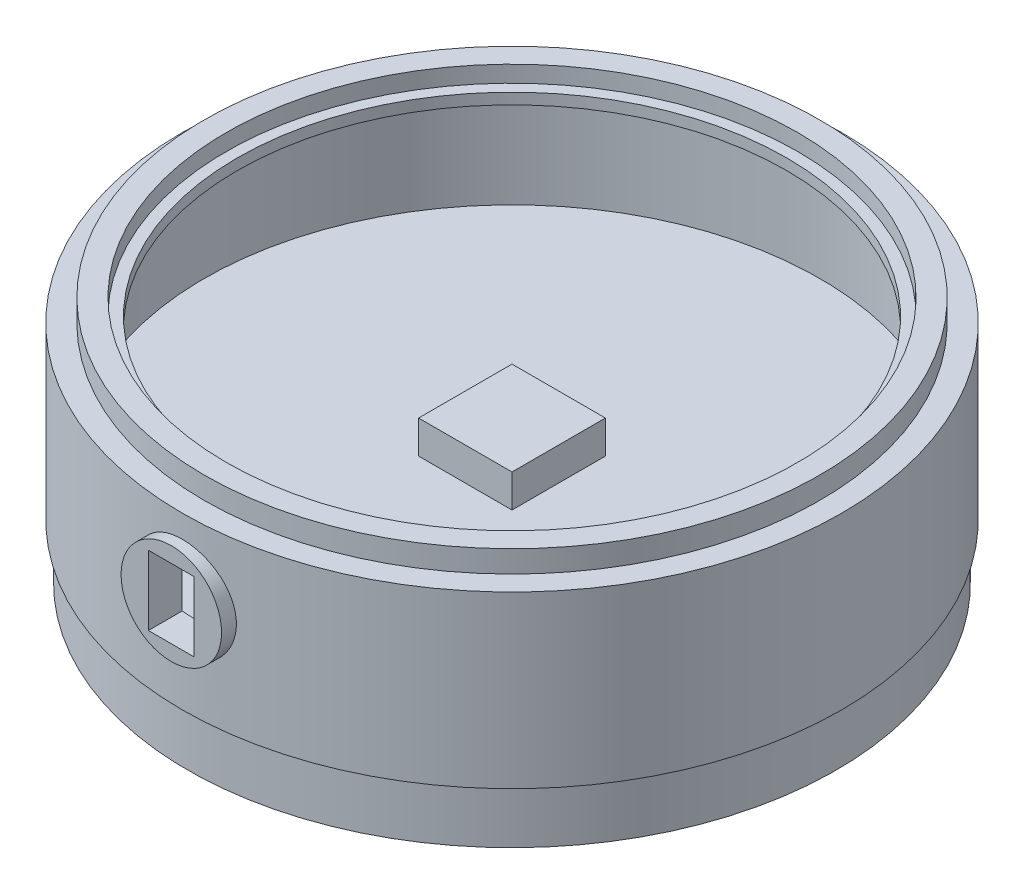
from build123d import *

# Parameters (mm, degrees)
SKETCH_1_R          = 30
EXTRUDE_1_DEPTH     = 1
SKETCH_10_R         = 30
SKETCH_10_R_2       = 28
EXTRUDE_4_DEPTH     = 10
SKETCH_11_W         = 8.5
SKETCH_11_H         = 8.5
EXTRUDE_5_DEPTH     = 3
EXTRUDE_START       = 29
SKETCH_17_R         = 4.571283513
EXTRUDE_6_DEPTH     = 2
SKETCH_18_W         = 4.174244664
SKETCH_18_H         = 6.326589568
CUT_EXTRUDE_5_DEPTH = 10
SKETCH_19_R         = 30
SKETCH_19_R_2       = 25
EXTRUDE_7_DEPTH     = 1
SKETCH_23_R         = 30
SKETCH_23_R_2       = 26
EXTRUDE_8_DEPTH     = 1.5
CUT_EXTRUDE_START   = -2
SKETCH_24_R         = 32
SKETCH_24_R_2       = 28
CUT_EXTRUDE_6_DEPTH = 2
EXTRUDE_START_2     = 4
SKETCH_25_R         = 30
EXTRUDE_9_DEPTH     = 4
SKETCH_26_R         = 1.5
CUT_EXTRUDE_7_DEPTH = 4
EXTRUDE_START_3     = 5
SKETCH_27_R         = 29.5
SKETCH_27_R_2       = 1.5
EXTRUDE_10_DEPTH    = 5


with BuildPart() as part:
    # 草图1 → 凸台-拉伸1 (new body)
    with BuildSketch(Plane(origin=(0, 0, 0), x_dir=(1, 0, 0), z_dir=(0, 1, 0))):
        with Locations(Location((0, 0, 0), (0, 0, 270))):
            Circle(SKETCH_1_R)
    extrude(amount=EXTRUDE_1_DEPTH)

    # 草图10 → 凸台-拉伸4 (add)
    with BuildSketch(Plane(origin=(0, 1, 0), x_dir=(1, 0, 0), z_dir=(0, 1, 0))):
        with Locations(Location((0, 0, 0), (0, 0, 270))):
            Circle(SKETCH_10_R)
        with Locations(Location((0, 0, 0), (0, 0, 270))):
            Circle(SKETCH_10_R_2, mode=Mode.SUBTRACT)
    extrude(amount=EXTRUDE_4_DEPTH)

    # 草图11 → 凸台-拉伸5 (add)
    with BuildSketch(Plane(origin=(0, 1, 0), x_dir=(1, 0, 0), z_dir=(0, 1, 0))):
        Rectangle(SKETCH_11_W, SKETCH_11_H)
    extrude(amount=EXTRUDE_5_DEPTH)

    # 草图17 → 凸台-拉伸6 (add)
    with BuildSketch(Plane.XY.offset(EXTRUDE_START)):
        with Locations(Location((0, 4.876571378, 0), (0, 0, 180))):
            Circle(SKETCH_17_R)
    extrude(amount=EXTRUDE_6_DEPTH)

    # 草图18 → 切除-拉伸5 (cut)
    with BuildSketch(Plane.XY.offset(31)):
        with Locations((0, 4.876571378)):
            Rectangle(SKETCH_18_W, SKETCH_18_H)
    extrude(amount=-CUT_EXTRUDE_5_DEPTH, mode=Mode.SUBTRACT)

    # 草图19 → 凸台-拉伸7 (add)
    with BuildSketch(Plane(origin=(0, 11, 0), x_dir=(1, 0, 0), z_dir=(0, 1, 0))):
        with Locations(Location((0, 0, 0), (0, 0, 270))):
            Circle(SKETCH_19_R)
        with Locations(Location((0, 0, 0), (0, 0, 270))):
            Circle(SKETCH_19_R_2, mode=Mode.SUBTRACT)
    extrude(amount=EXTRUDE_7_DEPTH)

    # 草图23 → 凸台-拉伸8 (add)
    with BuildSketch(Plane(origin=(0, 12, 0), x_dir=(1, 0, 0), z_dir=(0, 1, 0))):
        with Locations(Location((0, 0, 0), (0, 0, 270))):
            Circle(SKETCH_23_R)
        with Locations(Location((0, 0, 0), (0, 0, 270))):
            Circle(SKETCH_23_R_2, mode=Mode.SUBTRACT)
    extrude(amount=EXTRUDE_8_DEPTH)

    # 草图24 → 切除-拉伸6 (cut)
    with BuildSketch(Plane(origin=(0, 13.5, 0), x_dir=(1, 0, 0), z_dir=(0, 1, 0)).offset(CUT_EXTRUDE_START)):
        Circle(SKETCH_24_R)
        with Locations(Location((0, 0, 0), (0, 0, 270))):
            Circle(SKETCH_24_R_2, mode=Mode.SUBTRACT)
    extrude(amount=CUT_EXTRUDE_6_DEPTH, mode=Mode.SUBTRACT)

    # 草图25 → 凸台-拉伸9 (add)
    with BuildSketch(Plane.XZ.offset(EXTRUDE_START_2)):
        with Locations(Location((0, 0, 0), (0, 0, 270))):
            Circle(SKETCH_25_R)
    extrude(amount=-EXTRUDE_9_DEPTH)

    # 草图26 → 切除-拉伸7 (cut)
    with BuildSketch(Plane(origin=(0, -4, 0), x_dir=(-1, 0, 0), z_dir=(0, -1, 0))):
        with Locations(Location((-10.25961511, 17.034507364, 0), (0, 0, 90))):
            Circle(SKETCH_26_R)
        with Locations(Location((10.74038489, 17.034507364, 0), (0, 0, 270))):
            Circle(SKETCH_26_R)
        with Locations(Location((10.74038489, -16.965492636, 0), (0, 0, 90))):
            Circle(SKETCH_26_R)
        with Locations(Location((-10.25961511, -16.965492636, 0), (0, 0, 270))):
            Circle(SKETCH_26_R)
    extrude(amount=-CUT_EXTRUDE_7_DEPTH, mode=Mode.SUBTRACT)

    # 草图27 → 凸台-拉伸10 (add)
    with BuildSketch(Plane.XZ.offset(4).offset(EXTRUDE_START_3)):
        with Locations(Location((0, 0, 0), (0, 0, 270))):
            Circle(SKETCH_27_R)
        with Locations(Location((-10.74038489, 16.965492636, 0), (0, 0, 270))):
            Circle(SKETCH_27_R_2, mode=Mode.SUBTRACT)
        with Locations(Location((-10.74038489, -17.034507364, 0), (0, 0, 270))):
            Circle(SKETCH_27_R_2, mode=Mode.SUBTRACT)
        with Locations(Location((10.25961511, -17.034507364, 0), (0, 0, 270))):
            Circle(SKETCH_27_R_2, mode=Mode.SUBTRACT)
        with Locations(Location((10.25961511, 16.965492636, 0), (0, 0, 270))):
            Circle(SKETCH_27_R_2, mode=Mode.SUBTRACT)
    extrude(amount=-EXTRUDE_10_DEPTH)


solid = part.part
